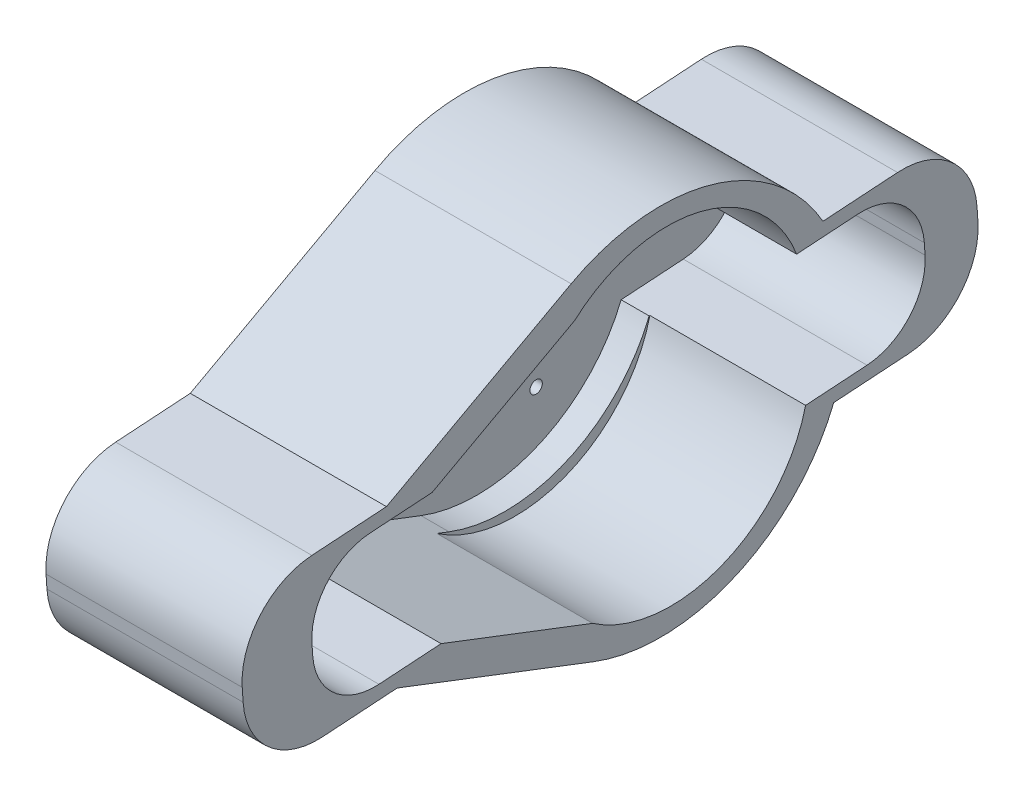
from build123d import *

# Parameters (mm, degrees)
BOSS_EXTRUDE1_DEPTH = 29.5
CUT_EXTRUDE1_START  = -25
SKETCH2_R           = 22.247000374
CUT_EXTRUDE1_DEPTH  = 25
BOSS_EXTRUDE2_DEPTH = 2
CUT_EXTRUDE2_DEPTH  = 135.751896149
SKETCH5_R           = 1.775
CUT_EXTRUDE4_DEPTH  = 5.5
SKETCH6_R           = 1
CUT_EXTRUDE5_DEPTH  = 136.658849751


with BuildPart() as part:
    # Sketch1 → Boss-Extrude1 (new body)
    with BuildSketch(Plane(origin=(15, 0, 0), x_dir=(0, 0, -1), z_dir=(1, 0, 0))):
        with BuildLine():
            Line((11.711350424, 51.059854885), (11.569757763, 53.200462368))
            ThreePointArc((11.569757763, 53.200462368), (7.502659229, 61.435263917), (-1.19609774, 64.382274981))
            Line((-1.19609774, 64.382274981), (-13.169931797, 63.590253536))
            ThreePointArc((-13.169931797, 63.590253536), (-31.030401227, 77.615886129), (-53.600949688, 75.108879931))
            Line((-53.600949688, 75.108879931), (-83.257445184, 58.954243603))
            Line((-83.257445184, 58.954243603), (-95.231279241, 58.162222158))
            ThreePointArc((-95.231279241, 58.162222158), (-103.466080789, 54.095123625), (-106.413091853, 45.396366656))
            Line((-106.413091853, 45.396366656), (-106.271499192, 43.255759172))
            ThreePointArc((-106.271499192, 43.255759172), (-102.204400659, 35.020957624), (-93.50564369, 32.07394656))
            Line((-93.50564369, 32.07394656), (-81.531809632, 32.865968005))
            Line((-81.531809632, 32.865968005), (-50.005875623, 20.758305769))
            ThreePointArc((-50.005875623, 20.758305769), (-27.30176025, 21.246038307), (-11.444296246, 37.501977938))
            Line((-11.444296246, 37.501977938), (0.529537812, 38.293999383))
            ThreePointArc((0.529537812, 38.293999383), (8.76433936, 42.361097916), (11.711350424, 51.059854885))
        make_face()
        with BuildLine():
            Line((3.217758765, 50.677202056), (3.09976488, 52.461041626))
            ThreePointArc((3.09976488, 52.461041626), (-0.289483897, 59.323376249), (-7.538448038, 61.779218803))
            Line((-7.538448038, 61.779218803), (-17.516643086, 61.119200932))
            ThreePointArc((-17.516643086, 61.119200932), (-32.400367611, 72.807228093), (-51.209157995, 70.718056262))
            Line((-51.209157995, 70.718056262), (-75.922904242, 57.255859321))
            Line((-75.922904242, 57.255859321), (-85.901099289, 56.595841451))
            ThreePointArc((-85.901099289, 56.595841451), (-92.763433913, 53.206592673), (-95.219276466, 45.957628532))
            Line((-95.219276466, 45.957628532), (-95.101282582, 44.173788963))
            ThreePointArc((-95.101282582, 44.173788963), (-91.712033804, 37.311454339), (-84.463069663, 34.855611786))
            Line((-84.463069663, 34.855611786), (-74.484874616, 35.515629656))
            Line((-74.484874616, 35.515629656), (-48.213262941, 25.425911127))
            ThreePointArc((-48.213262941, 25.425911127), (-29.293166796, 25.832354908), (-16.07861346, 39.378971267))
            Line((-16.07861346, 39.378971267), (-6.100418412, 40.038989138))
            ThreePointArc((-6.100418412, 40.038989138), (0.761916211, 43.428237915), (3.217758765, 50.677202056))
        make_face(mode=Mode.SUBTRACT)
    extrude(amount=-BOSS_EXTRUDE1_DEPTH)

    # Sketch2 → Cut-Extrude1 (cut)
    with BuildSketch(Plane(origin=(15, 0, 0), x_dir=(0, 0, -1), z_dir=(1, 0, 0)).offset(CUT_EXTRUDE1_START)):
        with Locations((-38.176329446, 53.173227685)):
            Circle(SKETCH2_R)
        with Locations((-37.60491264, 44.534509548)):
            Circle(SKETCH2_R)
    extrude(amount=CUT_EXTRUDE1_DEPTH, mode=Mode.SUBTRACT)

    # Sketch3 → Boss-Extrude2 (add)
    with BuildSketch(Plane.ZY.offset(14.5)):
        with BuildLine():
            Line((83.257445184, 58.954243603), (53.600949688, 75.108879931))
            ThreePointArc((53.600949688, 75.108879931), (31.030401227, 77.615886129), (13.169931797, 63.590253536))
            Line((13.169931797, 63.590253536), (1.19609774, 64.382274981))
            ThreePointArc((1.19609774, 64.382274981), (-7.502659229, 61.435263917), (-11.569757763, 53.200462368))
            Line((-11.569757763, 53.200462368), (-11.711350424, 51.059854885))
            ThreePointArc((-11.711350424, 51.059854885), (-8.76433936, 42.361097916), (-0.529537812, 38.293999383))
            Line((-0.529537812, 38.293999383), (11.444296246, 37.501977938))
            ThreePointArc((11.444296246, 37.501977938), (27.30176025, 21.246038307), (50.005875623, 20.758305769))
            Line((50.005875623, 20.758305769), (81.531809632, 32.865968005))
            Line((81.531809632, 32.865968005), (93.50564369, 32.07394656))
            ThreePointArc((93.50564369, 32.07394656), (102.204400659, 35.020957624), (106.271499192, 43.255759172))
            Line((106.271499192, 43.255759172), (106.413091853, 45.396366656))
            ThreePointArc((106.413091853, 45.396366656), (103.466080789, 54.095123625), (95.231279241, 58.162222158))
            Line((95.231279241, 58.162222158), (83.257445184, 58.954243603))
        make_face()
        with BuildLine():
            ThreePointArc((74.264539557, 44.823732686), (72.076754007, 50.799817892), (66.100668801, 48.612032342))
            ThreePointArc((66.100668801, 48.612032342), (68.288454351, 42.635947136), (74.264539557, 44.823732686))
        make_face(mode=Mode.SUBTRACT)
    extrude(amount=BOSS_EXTRUDE2_DEPTH)

    # Sketch4 → Cut-Extrude2 (cut, through all)
    with BuildSketch(Plane(origin=(-10, 0, 0), x_dir=(0, 0, -1), z_dir=(1, 0, 0))):
        with BuildLine():
            ThreePointArc((-73.418847587, 51.830670487), (-72.378344752, 51.449752714), (-71.997426979, 52.490255549))
            ThreePointArc((-71.997426979, 52.490255549), (-73.037929814, 52.871173322), (-73.418847587, 51.830670487))
        make_face()
        with BuildLine():
            ThreePointArc((-64.029313371, 49.573208149), (-65.069816206, 49.954125922), (-65.450733979, 48.913623087))
            ThreePointArc((-65.450733979, 48.913623087), (-64.410231144, 48.532705314), (-64.029313371, 49.573208149))
        make_face()
        with BuildLine():
            ThreePointArc((-74.914474378, 44.522141941), (-75.954977214, 44.903059714), (-76.335894987, 43.862556879))
            ThreePointArc((-76.335894987, 43.862556879), (-75.295392151, 43.481639106), (-74.914474378, 44.522141941))
        make_face()
        with BuildLine():
            ThreePointArc((-66.946360771, 41.605094541), (-67.986863606, 41.986012314), (-68.367781379, 40.945509479))
            ThreePointArc((-68.367781379, 40.945509479), (-67.327278544, 40.564591706), (-66.946360771, 41.605094541))
        make_face()
    extrude(amount=-CUT_EXTRUDE2_DEPTH, mode=Mode.SUBTRACT)

    # Sketch5 → Cut-Extrude4 (cut)
    with BuildSketch(Plane(origin=(-10, 0, 0), x_dir=(0, 0, -1), z_dir=(1, 0, 0))):
        with Locations((-72.708137283, 52.160463018)):
            Circle(SKETCH5_R)
        with Locations((-64.740023675, 49.243415618)):
            Circle(SKETCH5_R)
        with Locations((-67.657071075, 41.27530201)):
            Circle(SKETCH5_R)
        with Locations((-75.625184683, 44.19234941)):
            Circle(SKETCH5_R)
    extrude(amount=-CUT_EXTRUDE4_DEPTH, mode=Mode.SUBTRACT)

    # Sketch6 → Cut-Extrude5 (cut, through all)
    with BuildSketch(Plane(origin=(-14.5, 0, 0), x_dir=(0, 0, -1), z_dir=(1, 0, 0))):
        with Locations(Location((-29.729663164, 34.080294384, 0), (0, 0, 90))):
            Circle(SKETCH6_R)
        with Locations(Location((-53.93384306, 39.243401547, 0), (0, 0, 90))):
            Circle(SKETCH6_R)
        with Locations(Location((-24.566556001, 58.28447428, 0), (0, 0, 90))):
            Circle(SKETCH6_R)
        with Locations(Location((-48.770735897, 63.447581443, 0), (0, 0, 90))):
            Circle(SKETCH6_R)
    extrude(amount=-CUT_EXTRUDE5_DEPTH, mode=Mode.SUBTRACT)


solid = part.part
